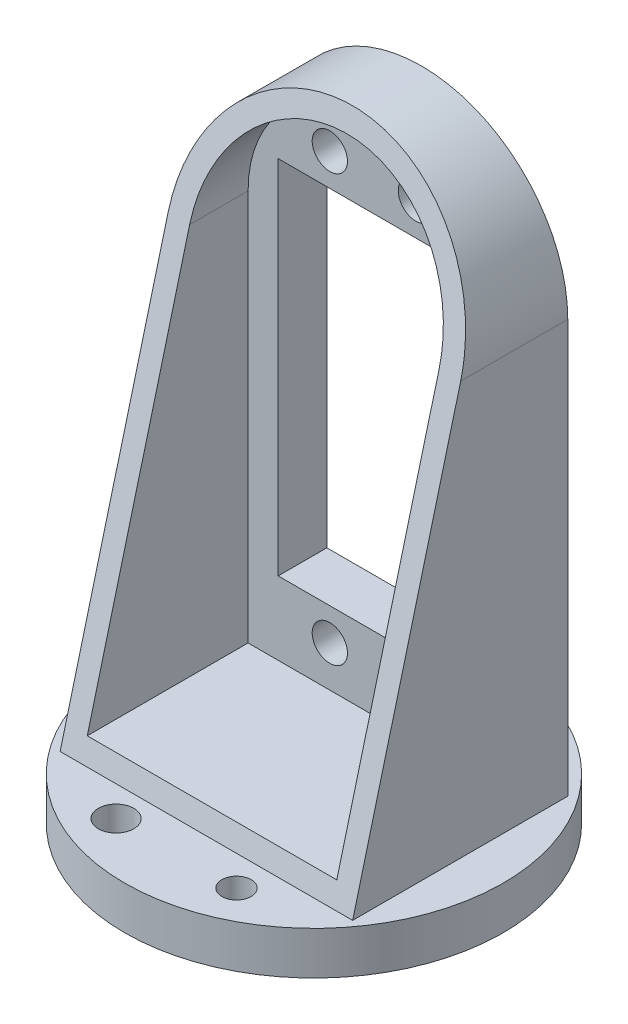
from build123d import *

# Parameters (mm, degrees)
CROQUIS1_R              = 22
SALIENTE_EXTRUIR1_DEPTH = 5
CROQUIS2_R              = 2.05
CROQUIS2_R_2            = 2.065143699
CROQUIS2_R_3            = 1.702015819
CORTAR_EXTRUIR1_DEPTH   = 5
CROQUIS3_W              = 34
CROQUIS3_H              = 25
SALIENTE_EXTRUIR2_DEPTH = 48
SALIENTE_EXTRUIR3_DEPTH = 25
CORTAR_EXTRUIR2_DEPTH   = 19.346
CROQUIS6_R              = 2.049356991
CROQUIS6_R_2            = 2.05
CROQUIS6_W              = 22
CROQUIS6_H              = 42
CORTAR_EXTRUIR3_DEPTH   = 19.346
CORTAR_EXTRUIR4_DEPTH   = 49.346


with BuildPart() as part:
    # Croquis1 → Saliente-Extruir1 (new body)
    with BuildSketch(Plane(origin=(0, 0, 0), x_dir=(1, 0, 0), z_dir=(0, 1, 0))):
        with Locations(Location((0, 0, 0), (0, 0, 270))):
            Circle(CROQUIS1_R)
    extrude(amount=SALIENTE_EXTRUIR1_DEPTH)

    # Croquis2 → Cortar-Extruir1 (cut)
    with BuildSketch(Plane(origin=(0, 5, 0), x_dir=(1, 0, 0), z_dir=(0, 1, 0))):
        with Locations(Location((0, 17.5, 0), (0, 0, 270))):
            Circle(CROQUIS2_R)
        with Locations(Location((-7, -15.999727998, 0), (0, 0, 270))):
            Circle(CROQUIS2_R_2)
        with Locations(Location((7, -15.999727998, 0), (0, 0, 270))):
            Circle(CROQUIS2_R_3)
    extrude(amount=-CORTAR_EXTRUIR1_DEPTH, mode=Mode.SUBTRACT)

    # Croquis3 → Saliente-Extruir2 (add)
    with BuildSketch(Plane(origin=(0, 5, 0), x_dir=(1, 0, 0), z_dir=(0, 1, 0))):
        Rectangle(CROQUIS3_W, CROQUIS3_H)
    extrude(amount=SALIENTE_EXTRUIR2_DEPTH)

    # Croquis4 → Saliente-Extruir3 (add)
    with BuildSketch(Plane(origin=(0, 0, -12.5), x_dir=(-1, 0, 0), z_dir=(0, 0, -1))):
        with BuildLine():
            Line((-17, 53), (17, 53))
            ThreePointArc((17, 53), (0, 70), (-17, 53))
        make_face()
    extrude(amount=-SALIENTE_EXTRUIR3_DEPTH)

    # Croquis5 → Cortar-Extruir2 (cut)
    with BuildSketch(Plane.XY.offset(12.5)):
        with BuildLine():
            Line((14.5, 7.5), (14.5, 53))
            ThreePointArc((14.5, 53), (0, 67.5), (-14.5, 53))
            Line((-14.5, 53), (-14.5, 7.5))
            Line((-14.5, 7.5), (14.5, 7.5))
        make_face()
    extrude(amount=-CORTAR_EXTRUIR2_DEPTH, mode=Mode.SUBTRACT)

    # Croquis6 → Cortar-Extruir3 (cut)
    with BuildSketch(Plane.XY.offset(-6.846)):
        with Locations((-5, 12.250643009)):
            Circle(CROQUIS6_R)
        with Locations((5, 12.250643009)):
            Circle(CROQUIS6_R)
        with Locations((-5, 61.75)):
            Circle(CROQUIS6_R_2)
        with Locations((5, 61.75)):
            Circle(CROQUIS6_R_2)
        with Locations((0, 37)):
            Rectangle(CROQUIS6_W, CROQUIS6_H)
    extrude(amount=-CORTAR_EXTRUIR3_DEPTH, mode=Mode.SUBTRACT)

    # Croquis7 → Cortar-Extruir4 (cut)
    with BuildSketch(Plane(origin=(17, 0, 0), x_dir=(0, 0, -1), z_dir=(1, 0, 0))):
        Polygon((-12.5, 53), (0.054068921, 53), (10.400499838, 92.559180941), (-12.5, 92.559180941), align=None)
        Polygon((-12.5, 53), (-12.5, 5), (0.054068921, 53), align=None)
    extrude(amount=-CORTAR_EXTRUIR4_DEPTH, mode=Mode.SUBTRACT)


solid = part.part
